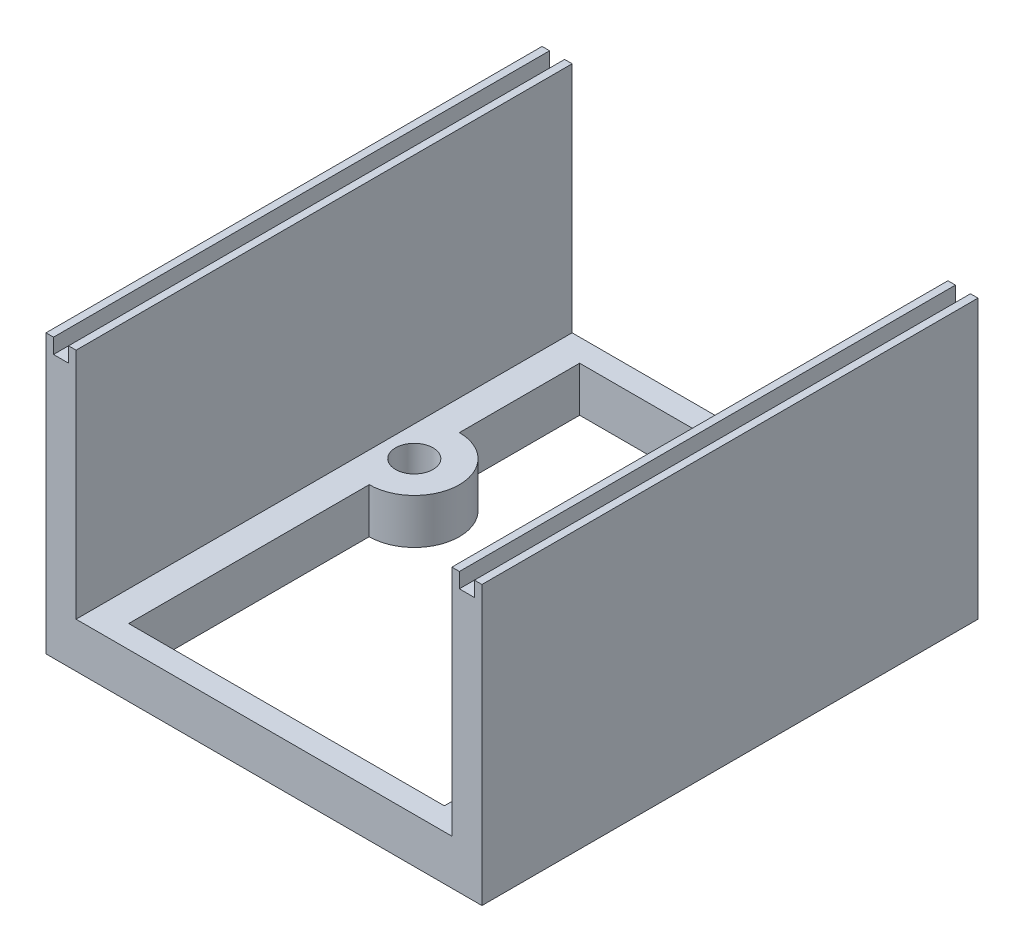
from build123d import *

# Parameters (mm, degrees)
SKETCH1_W           = 24
SKETCH1_H           = 33
BOSS_EXTRUDE2_DEPTH = 3
SKETCH2_R           = 1.25
CUT_EXTRUDE2_DEPTH  = 3
SKETCH4_W           = 2.5
SKETCH4_H           = 33
BOSS_EXTRUDE3_DEPTH = 3
SKETCH5_W           = 2
SKETCH5_H           = 33
BOSS_EXTRUDE4_DEPTH = 15.5
SKETCH6_W           = 1
SKETCH6_H           = 33
CUT_EXTRUDE3_DEPTH  = 1


with BuildPart() as part:
    # Sketch1 → Boss-Extrude2 (new body)
    with BuildSketch(Plane(origin=(0, 0, 0), x_dir=(1, 0, 0), z_dir=(0, 1, 0))):
        Rectangle(SKETCH1_W, SKETCH1_H)
        with BuildLine():
            Line((10.5, 7), (10.5, 15))
            Line((10.5, 15), (-10.5, 15))
            Line((-10.5, 15), (-10.5, 7))
            ThreePointArc((-10.5, 7), (-7.5, 4), (-10.5, 1))
            Line((-10.5, 1), (-10.5, -15))
            Line((-10.5, -15), (10.5, -15))
            Line((10.5, -15), (10.5, 1))
            ThreePointArc((10.5, 1), (7.5, 4), (10.5, 7))
        make_face(mode=Mode.SUBTRACT)
    extrude(amount=BOSS_EXTRUDE2_DEPTH)

    # Sketch2 → Cut-Extrude2 (cut)
    with BuildSketch(Plane(origin=(0, 3, 0), x_dir=(1, 0, 0), z_dir=(0, 1, 0))):
        with Locations(Location((-10.5, 4, 0), (0, 0, 270))):
            Circle(SKETCH2_R)
        with Locations(Location((10.5, 4, 0), (0, 0, 270))):
            Circle(SKETCH2_R)
    extrude(amount=-CUT_EXTRUDE2_DEPTH, mode=Mode.SUBTRACT)

    # Sketch4 → Boss-Extrude3 (add)
    with BuildSketch(Plane(origin=(0, 3, 0), x_dir=(1, 0, 0), z_dir=(0, 1, 0))):
        with Locations((-13.25, 0)):
            Rectangle(SKETCH4_W, SKETCH4_H)
        with Locations((13.25, 0)):
            Rectangle(SKETCH4_W, SKETCH4_H)
    extrude(amount=-BOSS_EXTRUDE3_DEPTH)

    # Sketch5 → Boss-Extrude4 (add)
    with BuildSketch(Plane(origin=(0, 3, 0), x_dir=(1, 0, 0), z_dir=(0, 1, 0))):
        with Locations((-13.5, 0)):
            Rectangle(SKETCH5_W, SKETCH5_H)
        with Locations((13.5, 0)):
            Rectangle(SKETCH5_W, SKETCH5_H)
    extrude(amount=BOSS_EXTRUDE4_DEPTH)

    # Sketch6 → Cut-Extrude3 (cut)
    with BuildSketch(Plane(origin=(0, 18.5, 0), x_dir=(1, 0, 0), z_dir=(0, 1, 0))):
        with Locations((13.5, 0)):
            Rectangle(SKETCH6_W, SKETCH6_H)
        with Locations((-13.5, 0)):
            Rectangle(SKETCH6_W, SKETCH6_H)
    extrude(amount=-CUT_EXTRUDE3_DEPTH, mode=Mode.SUBTRACT)


solid = part.part
